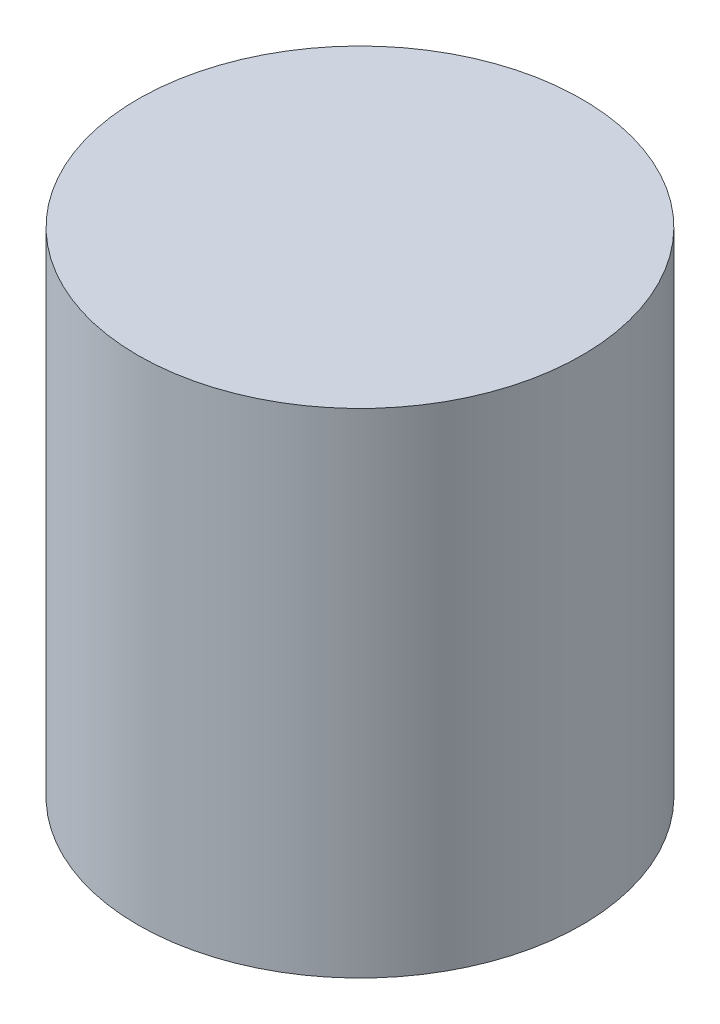
from build123d import *

# Parameters (mm, degrees)
SKETCH1_R           = 90
BOSS_EXTRUDE1_DEPTH = 200


with BuildPart() as part:
    # Sketch1 → Boss-Extrude1 (new body)
    with BuildSketch(Plane(origin=(0, 0, 0), x_dir=(1, 0, 0), z_dir=(0, 1, 0))):
        with Locations(Location((0, 0, 0), (0, 0, 270))):
            Circle(SKETCH1_R)
    extrude(amount=BOSS_EXTRUDE1_DEPTH)


solid = part.part
